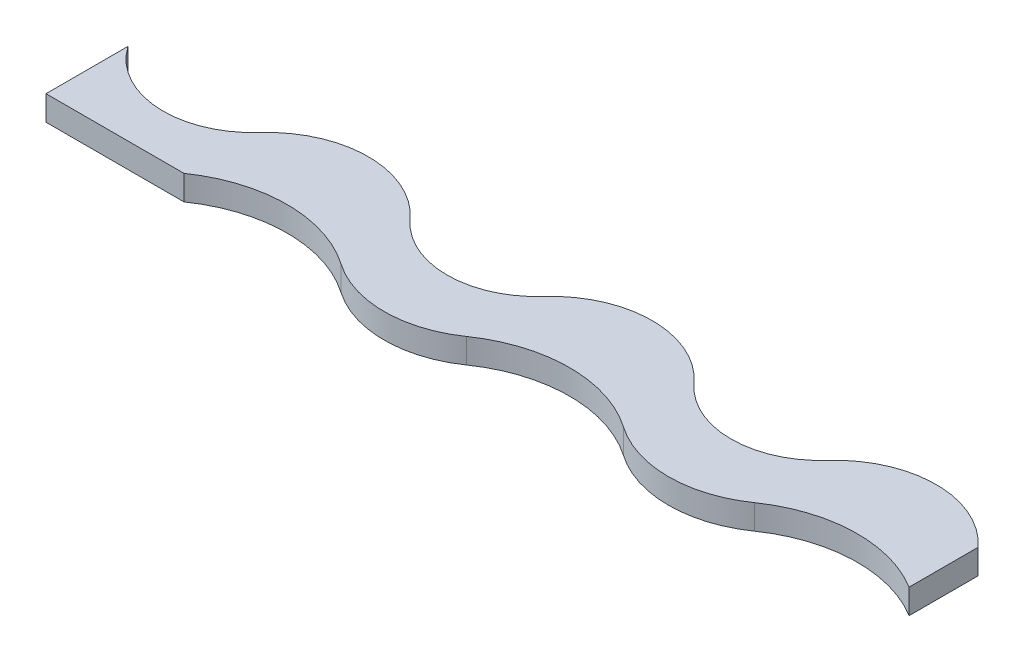
from build123d import *

# Parameters (mm, degrees)
BOSS_EXTRUDE1_DEPTH = 2


with BuildPart() as part:
    # Sketch2 → Boss-Extrude1 (new body)
    with BuildSketch(Plane(origin=(0, 0, 0), x_dir=(1, 0, 0), z_dir=(0, 1, 0))):
        with BuildLine():
            Line((0, 0), (0, 6.63))
            ThreePointArc((0, 6.63), (5.49918056, 3.525064844), (11.346717944, 5.91))
            ThreePointArc((11.346717944, 5.91), (17.433302094, 8.62038484), (23.519886243, 5.91))
            ThreePointArc((23.519886243, 5.91), (28.908302094, 3.510512821), (34.296717944, 5.91))
            ThreePointArc((34.296717944, 5.91), (40.383302094, 8.62038484), (46.469886243, 5.91))
            ThreePointArc((46.469886243, 5.91), (51.858302094, 3.510512821), (57.246717944, 5.91))
            ThreePointArc((57.246717944, 5.91), (63.333302094, 8.62038484), (69.419886243, 5.91))
            Line((69.419886243, 5.91), (69.419886243, 0.34303853))
            ThreePointArc((69.419886243, 0.34303853), (63.282196464, 1.985068989), (57.246717944, 0))
            ThreePointArc((57.246717944, 0), (51.963740367, -1.655479057), (46.680762789, 0))
            ThreePointArc((46.680762789, 0), (40.331907408, 1.989483575), (33.983052027, 0))
            ThreePointArc((33.983052027, 0), (28.915381395, -1.58801026), (23.847710762, 0))
            ThreePointArc((23.847710762, 0), (17.498855381, 1.989483575), (11.15, 0))
            Line((11.15, 0), (0, 0))
        make_face()
    extrude(amount=BOSS_EXTRUDE1_DEPTH)


solid = part.part
